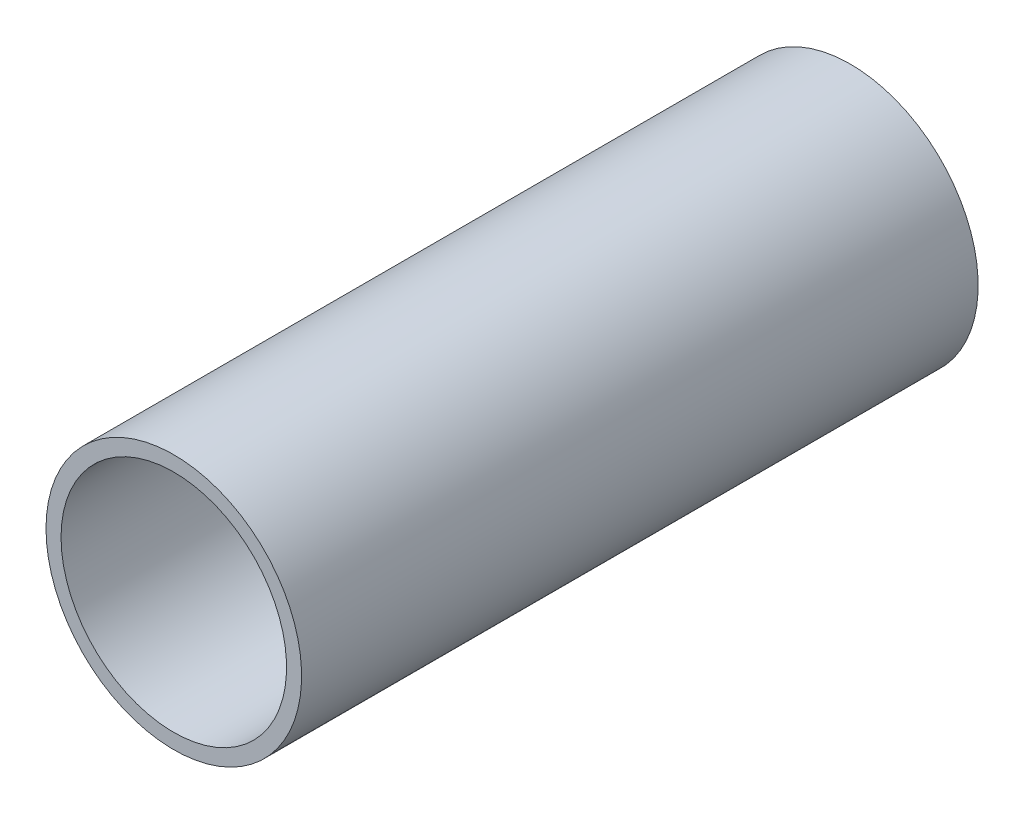
from build123d import *

# Parameters (mm, degrees)
SKETCH1_R           = 17
SKETCH1_R_2         = 15
BOSS_EXTRUDE1_DEPTH = 90


with BuildPart() as part:
    # Sketch1 → Boss-Extrude1 (new body)
    with BuildSketch(Plane.XY):
        with Locations(Location((0, 0, 0), (0, 0, 180))):
            Circle(SKETCH1_R)
        with Locations(Location((0, 0, 0), (0, 0, 180))):
            Circle(SKETCH1_R_2, mode=Mode.SUBTRACT)
    extrude(amount=BOSS_EXTRUDE1_DEPTH)


solid = part.part
